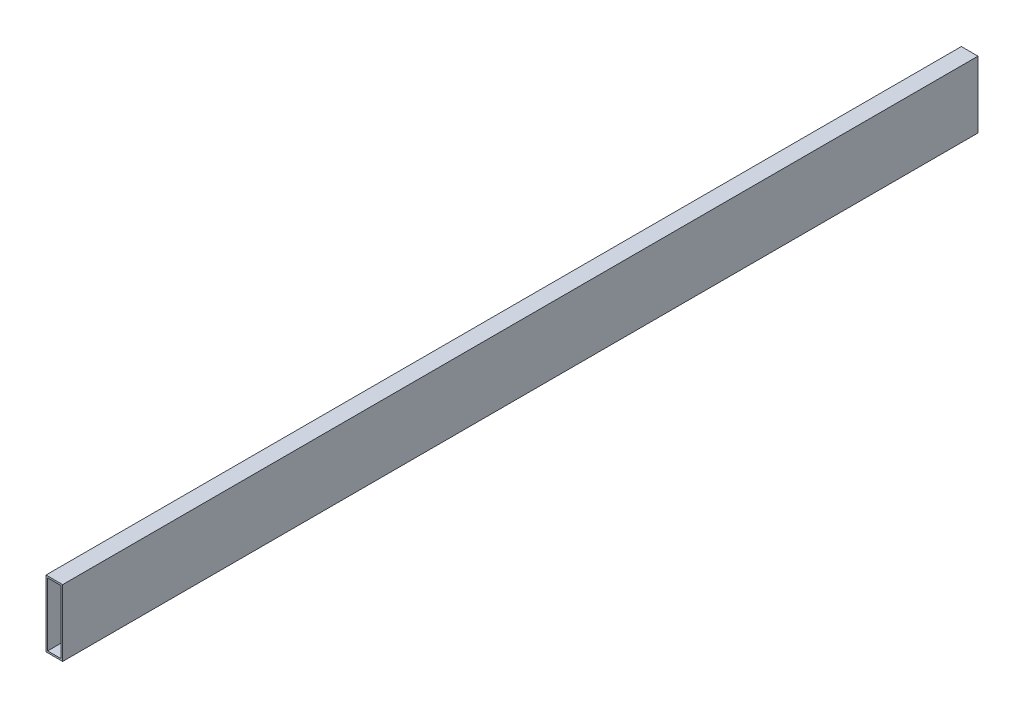
from build123d import *

# Parameters (mm, degrees)
SKETCH_1_W      = 10
SKETCH_1_H      = 40
SKETCH_1_W_2    = 8
SKETCH_1_H_2    = 38
EXTRUDE_1_DEPTH = 550


with BuildPart() as part:
    # 草图1 → 凸台-拉伸1 (new body)
    with BuildSketch(Plane.XY):
        Rectangle(SKETCH_1_W, SKETCH_1_H)
        Rectangle(SKETCH_1_W_2, SKETCH_1_H_2, mode=Mode.SUBTRACT)
    extrude(amount=EXTRUDE_1_DEPTH)


solid = part.part
